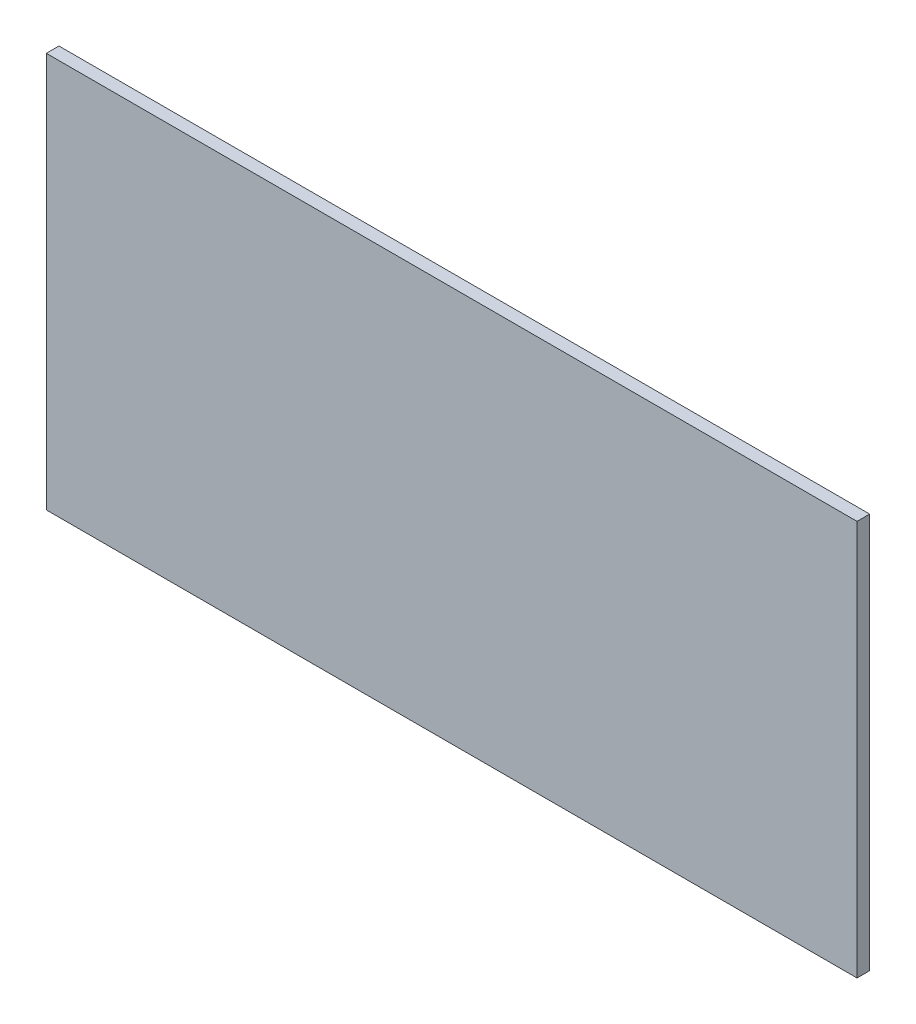
from build123d import *

# Parameters (mm, degrees)
SKETCH1_W           = 1171.575
SKETCH1_H           = 571.5
BOSS_EXTRUDE1_DEPTH = 18.25625


with BuildPart() as part:
    # Sketch1 → Boss-Extrude1 (new body)
    with BuildSketch(Plane.XY):
        with Locations((0, 285.75)):
            Rectangle(SKETCH1_W, SKETCH1_H)
    extrude(amount=BOSS_EXTRUDE1_DEPTH)


solid = part.part
